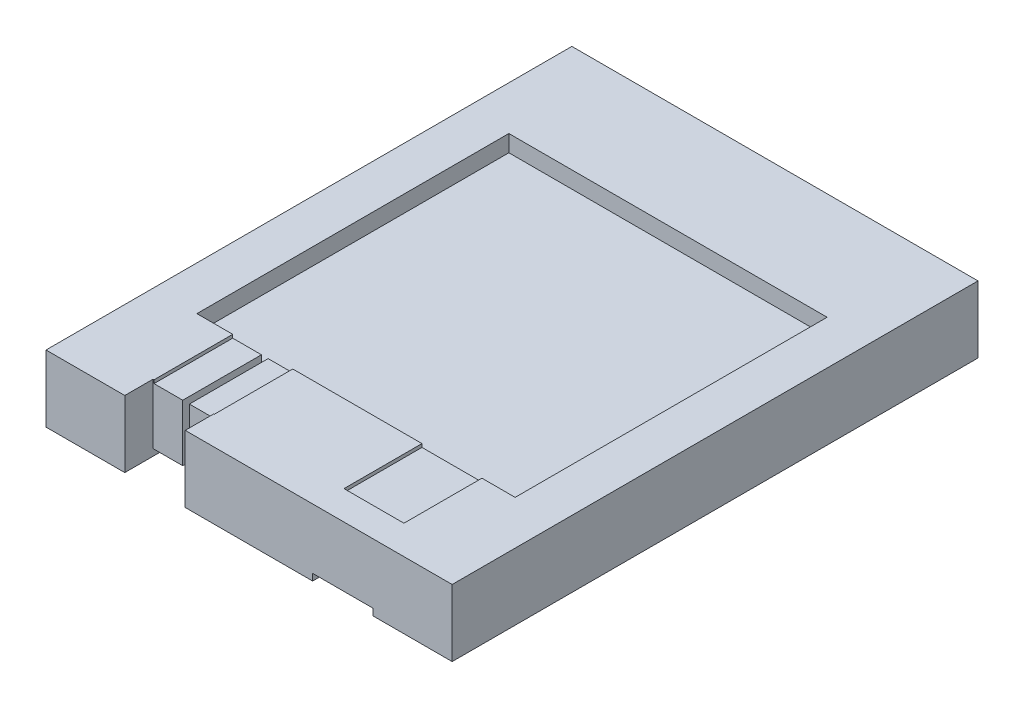
from build123d import *

# Parameters (mm, degrees)
SKETCH1_W           = 121.603901538
SKETCH1_H           = 157.438867692
BOSS_EXTRUDE1_DEPTH = 20
SKETCH2_W           = 17.97576728
SKETCH2_H           = 23.568228212
SKETCH2_W_2         = 17.951314889
SKETCH2_H_2         = 23.536168411
CUT_EXTRUDE1_DEPTH  = 1
SKETCH3_W           = 95.285802818
SKETCH3_H           = 93.40563605
CUT_EXTRUDE2_DEPTH  = 5
SKETCH5_W           = 18.1
SKETCH5_H           = 157.438867692
CUT_EXTRUDE3_DEPTH  = 2
SKETCH6_W           = 2
SKETCH6_H           = 18
CUT_EXTRUDE4_DEPTH  = 33
SKETCH8_W           = 18.1
SKETCH8_H           = 18
CUT_EXTRUDE5_DEPTH  = 8.45273398


with BuildPart() as part:
    # Sketch1 → Boss-Extrude1 (new body)
    with BuildSketch(Plane(origin=(0, 0, 0), x_dir=(1, 0, 0), z_dir=(0, 1, 0))):
        Rectangle(SKETCH1_W, SKETCH1_H)
    extrude(amount=BOSS_EXTRUDE1_DEPTH)

    # Sketch2 → Cut-Extrude1 (cut)
    with BuildSketch(Plane(origin=(0, 20, 0), x_dir=(1, 0, 0), z_dir=(0, 1, 0))):
        with Locations((-27.924267606, -58.48258576)):
            Rectangle(SKETCH2_W, SKETCH2_H)
        with Locations((28.722103823, -58.283126705)):
            Rectangle(SKETCH2_W_2, SKETCH2_H_2)
    extrude(amount=-CUT_EXTRUDE1_DEPTH, mode=Mode.SUBTRACT)

    # Sketch3 → Cut-Extrude2 (cut)
    with BuildSketch(Plane(origin=(0, 20, 0), x_dir=(1, 0, 0), z_dir=(0, 1, 0))):
        Rectangle(SKETCH3_W, SKETCH3_H)
    extrude(amount=-CUT_EXTRUDE2_DEPTH, mode=Mode.SUBTRACT)

    # Sketch5 → Cut-Extrude3 (cut)
    with BuildSketch(Plane.XZ):
        with Locations((-28.163629981, 0)):
            Rectangle(SKETCH5_W, SKETCH5_H)
        with Locations((28.080400305, 0.136730642)):
            Rectangle(SKETCH5_W, SKETCH5_H)
    extrude(amount=-CUT_EXTRUDE3_DEPTH, mode=Mode.SUBTRACT)

    # Sketch6 → Cut-Extrude4 (cut)
    with BuildSketch(Plane(origin=(-36.912151246, 20, 46.702818025), x_dir=(1, 0, 0), z_dir=(0, 0, 1))):
        with Locations((9.598521265, -9)):
            Rectangle(SKETCH6_W, SKETCH6_H)
    extrude(amount=CUT_EXTRUDE4_DEPTH, mode=Mode.SUBTRACT)

    # Sketch8 → Cut-Extrude5 (cut)
    with BuildSketch(Plane.XY.offset(78.719433846)):
        with Locations((-28.163629981, 11)):
            Rectangle(SKETCH8_W, SKETCH8_H)
    extrude(amount=-CUT_EXTRUDE5_DEPTH, mode=Mode.SUBTRACT)


solid = part.part
